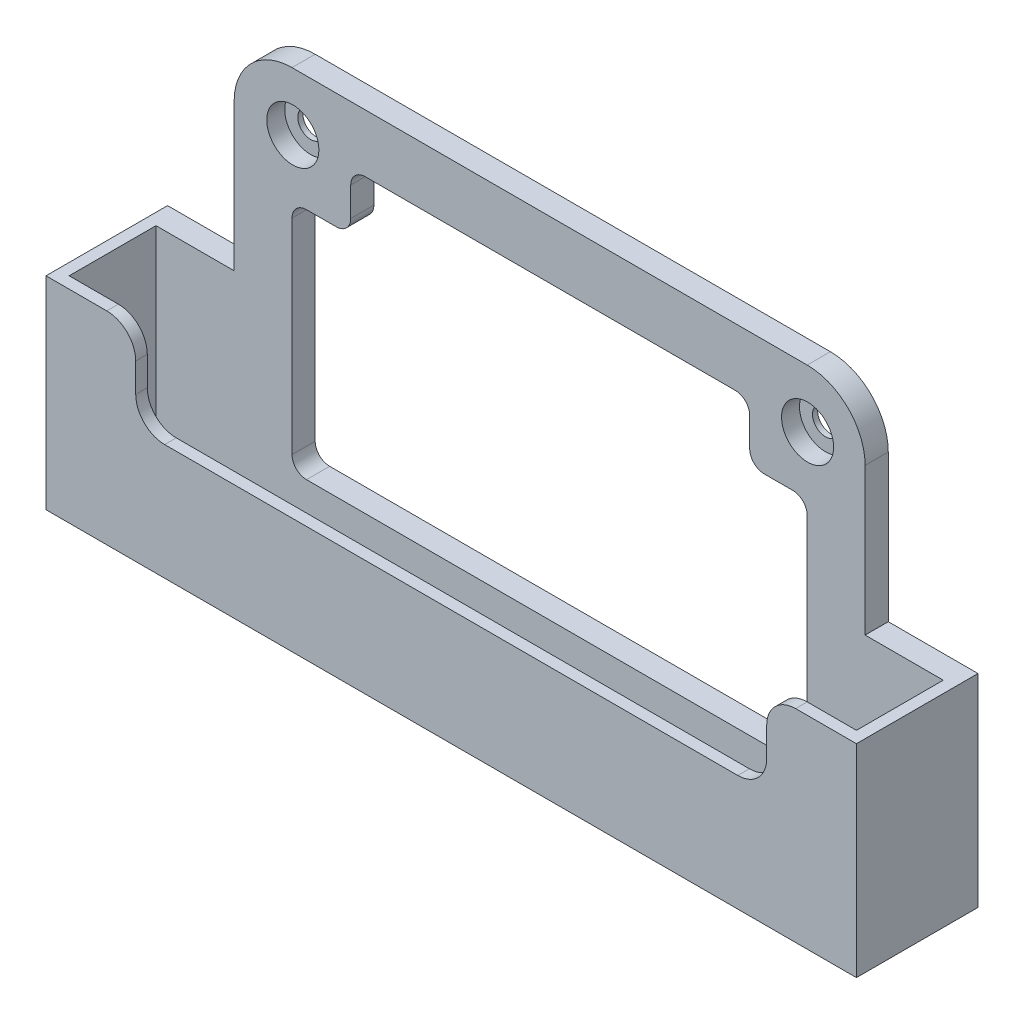
from build123d import *

# Parameters (mm, degrees)
SKETCH1_W                                        = 109
SKETCH1_H                                        = 140
BOSS_EXTRUDE1_DEPTH                              = 4
CBORE_FOR_M4_PAN_HEAD_MACHINE_SCREW1_D           = 4.5
CBORE_FOR_M4_PAN_HEAD_MACHINE_SCREW1_CBORE_D     = 9
CBORE_FOR_M4_PAN_HEAD_MACHINE_SCREW1_CBORE_DEPTH = 3.1
SKETCH6_W                                        = 25.091702427
SKETCH6_H                                        = 69.60512686
CUT_EXTRUDE1_DEPTH                               = 89.804560694
SKETCH7_W                                        = 140
SKETCH7_H                                        = 35
BOSS_EXTRUDE2_DEPTH                              = 4
FILLET1_R                                        = 10
BOSS_EXTRUDE3_DEPTH                              = 15
SKETCH9_W                                        = 2
SKETCH9_H                                        = 35
BOSS_EXTRUDE4_DEPTH                              = 140
CUT_EXTRUDE3_DEPTH                               = 101.444014257
SKETCH11_W                                       = 109
SKETCH11_H                                       = 15
CUT_EXTRUDE4_DEPTH                               = 2
FILLET6_R                                        = 5
CUT_EXTRUDE5_REACH                               = 103.198
SKETCH13_W                                       = 4
SKETCH13_H                                       = 73.569558417
CUT_EXTRUDE5_DIRECTION_2_REACH                   = 103.198
SKETCH14_W                                       = 4
SKETCH14_H                                       = 10
BOSS_EXTRUDE5_DEPTH                              = 38.816595147
FILLET9_R                                        = 2.5


with BuildPart() as part:
    # Sketch1 → Boss-Extrude1 (new body)
    with BuildSketch(Plane.XY):
        Rectangle(SKETCH1_W, SKETCH1_H)
    extrude(amount=BOSS_EXTRUDE1_DEPTH)

    # CBORE for M4 Pan Head Machine Screw1 (through all)
    with Locations(Plane.XY.offset(4)):
        with Locations((-19.408297573, 58.521958499), (19.408297573, 58.521958499), (-44.361823025, -9.60512686), (44.559866877, -9.60512686)):
            CounterBoreHole(CBORE_FOR_M4_PAN_HEAD_MACHINE_SCREW1_D / 2, CBORE_FOR_M4_PAN_HEAD_MACHINE_SCREW1_CBORE_D / 2, CBORE_FOR_M4_PAN_HEAD_MACHINE_SCREW1_CBORE_DEPTH)

    # Sketch6 → Cut-Extrude1 (cut, through all)
    with BuildSketch(Plane.XY.offset(4)):
        with Locations((-41.954148786, 35.19743657)):
            Rectangle(SKETCH6_W, SKETCH6_H)
        with Locations((41.954148786, 35.19743657)):
            Rectangle(SKETCH6_W, SKETCH6_H)
    extrude(amount=-CUT_EXTRUDE1_DEPTH, mode=Mode.SUBTRACT)

    # Sketch7 → Boss-Extrude2 (add, through all)
    with BuildSketch(Plane.XY.offset(4)):
        with Locations((0, -52.5)):
            Rectangle(SKETCH7_W, SKETCH7_H)
    extrude(amount=-BOSS_EXTRUDE2_DEPTH)

    # Fillet1
    fillet1_edges = [part.edges().sort_by_distance(p)[0] for p in [
        (-29.408297573, 70, 2),
        (-54.5, 0.39487314, 2),
        (29.408297573, 70, 2),
        (54.5, 0.39487314, 2),
    ]]
    fillet(fillet1_edges, radius=FILLET1_R)

    # Sketch8 → Boss-Extrude3 (add)
    with BuildSketch(Plane.XY.offset(4)):
        Polygon((-70, -35), (-70, -70), (70, -70), (70, -35), (68, -35), (68, -68), (-68, -68), (-68, -35), align=None)
    extrude(amount=BOSS_EXTRUDE3_DEPTH)

    # Sketch9 → Boss-Extrude4 (add, through all)
    with BuildSketch(Plane.ZY.offset(70)):
        with Locations((20, -52.5)):
            Rectangle(SKETCH9_W, SKETCH9_H)
    extrude(amount=-BOSS_EXTRUDE4_DEPTH)

    # Sketch10 → Cut-Extrude3 (cut, through all)
    with BuildSketch(Plane.XY.offset(4)):
        Polygon((-19.408297573, 48.521958499), (-9.408297573, 48.521958499), (-9.408297573, 60), (9.408297573, 60), (9.408297573, 48.521958499), (19.408297573, 48.521958499), (19.408297573, -9.60512686), (34.559866877, -9.60512686), (34.559866877, -19.60512686), (44.5, -19.60512686), (44.5, -60), (-44.5, -60), (-44.5, -19.60512686), (-34.361823025, -19.60512686), (-34.361823025, -9.60512686), (-19.408297573, -9.60512686), align=None)
    extrude(amount=-CUT_EXTRUDE3_DEPTH, mode=Mode.SUBTRACT)

    # Sketch11 → Cut-Extrude4 (cut)
    with BuildSketch(Plane.XY.offset(21)):
        with Locations((0, -42.5)):
            Rectangle(SKETCH11_W, SKETCH11_H)
    extrude(amount=-CUT_EXTRUDE4_DEPTH, mode=Mode.SUBTRACT)

    # Fillet6
    fillet6_edges = [part.edges().sort_by_distance(p)[0] for p in [
        (-54.5, -50, 20),
        (54.5, -50, 20),
        (54.5, -35, 20),
        (-54.5, -35, 20),
    ]]
    fillet(fillet6_edges, radius=FILLET6_R)

    # Cut-Extrude5: up to this face of the body (flat: up to its plane)
    cut_extrude5_end = Plane(part.part.faces().sort_by_distance((-29.408297573, 30.19743657, 2))[0])
    # Sketch13 → Cut-Extrude5 (cut, up to the picked face)
    with BuildSketch(Plane(origin=(0, 0, 0), x_dir=(0, 0, -1), z_dir=(1, 0, 0)), mode=Mode.PRIVATE) as cut_extrude5_sk1:
        with Locations((-2, 37.179652349)):
            Rectangle(SKETCH13_W, SKETCH13_H)
    cut_extrude5_tool1 = split(extrude(cut_extrude5_sk1.sketch, amount=-CUT_EXTRUDE5_REACH, mode=Mode.PRIVATE), bisect_by=cut_extrude5_end, keep=Keep.BOTH, mode=Mode.PRIVATE)
    add(cut_extrude5_tool1.solids().sort_by(Axis((0, 37.179652, 2), (-1, 0, 0)))[0], mode=Mode.SUBTRACT)

    # Cut-Extrude5 direction 2: up to this face of the body (flat: up to its plane)
    cut_extrude5_direction_2_end = Plane(part.part.faces().sort_by_distance((29.408297573, 30.19743657, 2))[0])
    # Sketch13 → Cut-Extrude5 direction 2 (cut, up to the picked face)
    with BuildSketch(Plane(origin=(0, 0, 0), x_dir=(0, 0, -1), z_dir=(1, 0, 0)), mode=Mode.PRIVATE) as cut_extrude5_direction_2_sk1:
        with Locations((-2, 37.179652349)):
            Rectangle(SKETCH13_W, SKETCH13_H)
    cut_extrude5_direction_2_tool1 = split(extrude(cut_extrude5_direction_2_sk1.sketch, amount=CUT_EXTRUDE5_DIRECTION_2_REACH, mode=Mode.PRIVATE), bisect_by=cut_extrude5_direction_2_end, keep=Keep.BOTH, mode=Mode.PRIVATE)
    add(cut_extrude5_direction_2_tool1.solids().sort_by(Axis((0, 37.179652, 2), (1, 0, 0)))[0], mode=Mode.SUBTRACT)

    # Sketch14 → Boss-Extrude5 (add)
    with BuildSketch(Plane.ZY.offset(-19.408297573)):
        with Locations((2, -4.60512686)):
            Rectangle(SKETCH14_W, SKETCH14_H)
    extrude(amount=BOSS_EXTRUDE5_DEPTH)

    # Fillet9
    fillet9_edges = [part.edges().sort_by_distance(p)[0] for p in [
        (34.559866877, -9.60512686, 2),
        (34.559866877, -19.60512686, 2),
        (44.5, -19.60512686, 2),
        (44.5, -60, 2),
        (-44.5, -60, 2),
        (-44.5, -19.60512686, 2),
        (-34.361823025, -19.60512686, 2),
        (-34.361823025, -9.60512686, 2),
    ]]
    fillet(fillet9_edges, radius=FILLET9_R)


solid = part.part
